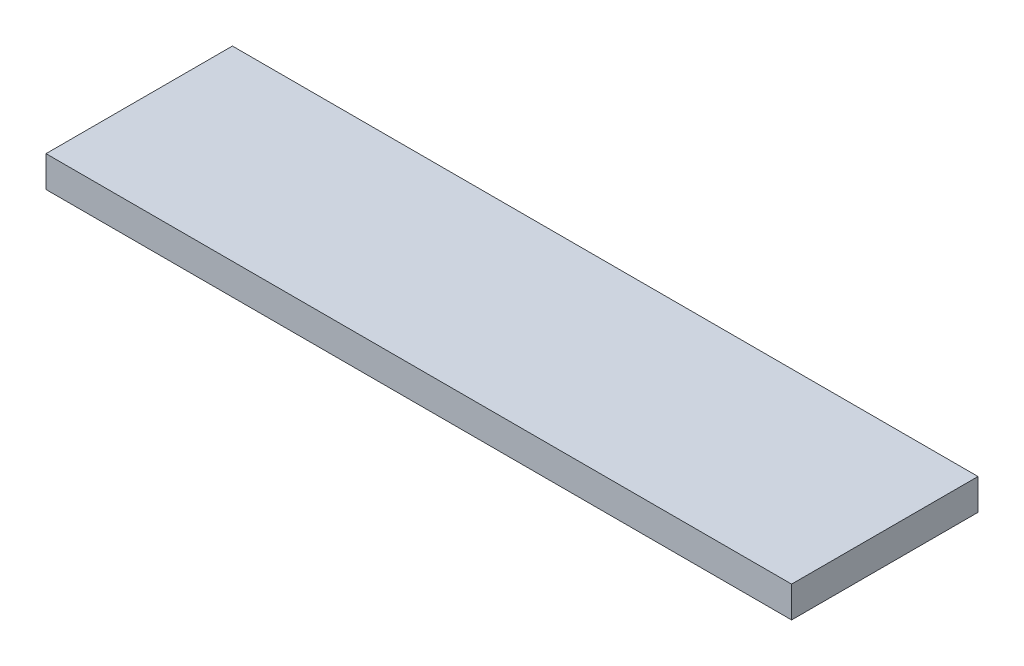
from build123d import *

# Parameters (mm, degrees)
SKETCH1_W           = 360
SKETCH1_H           = 90
BOSS_EXTRUDE1_DEPTH = 15


with BuildPart() as part:
    # Sketch1 → Boss-Extrude1 (new body)
    with BuildSketch(Plane(origin=(0, 0, 0), x_dir=(1, 0, 0), z_dir=(0, 1, 0))):
        Rectangle(SKETCH1_W, SKETCH1_H)
    extrude(amount=BOSS_EXTRUDE1_DEPTH)


solid = part.part
